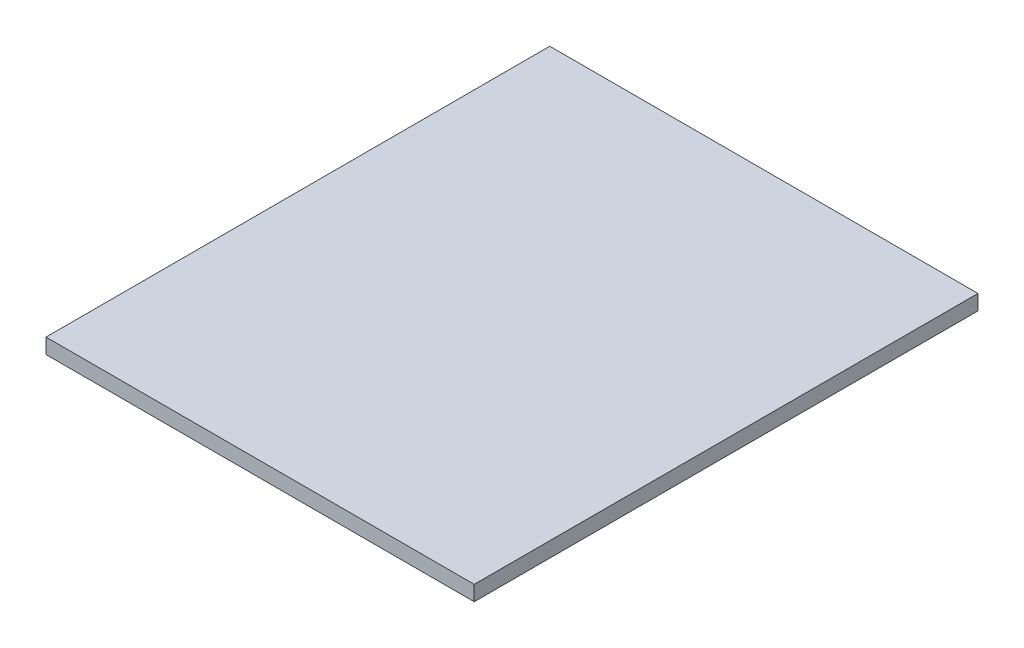
from build123d import *

# Parameters (mm, degrees)
SKETCH_1_W      = 85
SKETCH_1_H      = 100
EXTRUDE_1_DEPTH = 3


with BuildPart() as part:
    # Эскиз1 → Бобышка-Вытянуть1 (new body)
    with BuildSketch(Plane(origin=(0, 0, 0), x_dir=(1, 0, 0), z_dir=(0, 1, 0))):
        with Locations((42.5, 50)):
            Rectangle(SKETCH_1_W, SKETCH_1_H)
    extrude(amount=EXTRUDE_1_DEPTH)


solid = part.part
